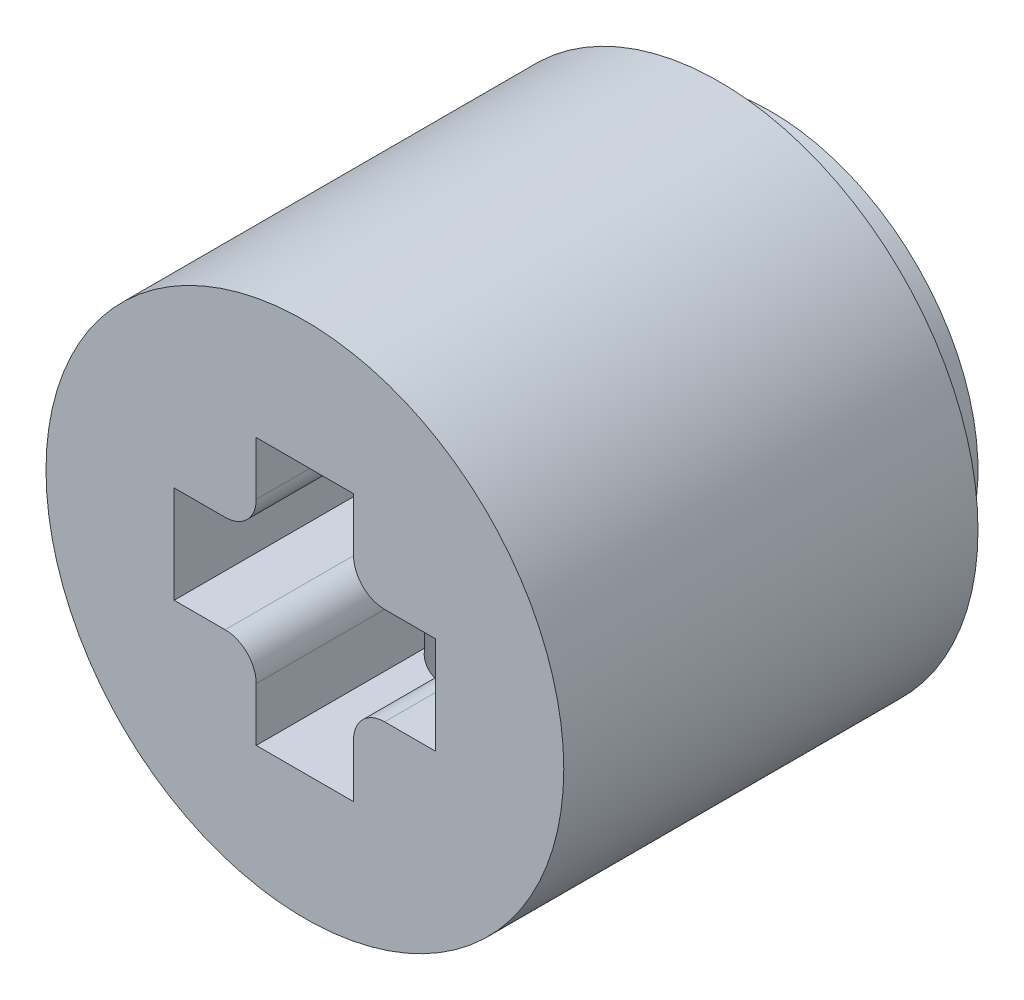
from build123d import *

# Parameters (mm, degrees)
SKETCH_1_R               = 5
EXTRUDE_1_DEPTH          = 8
SKETCH_4_R               = 4
EXTRUDE_2_DEPTH          = 1
SKETCH_2_W               = 5.05
SKETCH_2_H               = 1.88
SKETCH_2_W_2             = 1.88
SKETCH_2_H_2             = 5.15
CUT_EXTRUDE_1_DEPTH      = 12.445523142
FILLET_1_R               = 0.6
CUT_EXTRUDE_2_DEPTH      = 0.5
CUT_EXTRUDE_2_DEPTH_BACK = 13.098786096
SKETCH_3_R               = 1.2


with BuildPart() as part:
    # ｽｹｯﾁ1 → ﾎﾞｽ - 押し出し1 (new body)
    with BuildSketch(Plane.XY):
        Circle(SKETCH_1_R)
    extrude(amount=EXTRUDE_1_DEPTH)

    # ｽｹｯﾁ4 → ﾎﾞｽ - 押し出し2 (add)
    with BuildSketch(Plane(origin=(0, 0, 0), x_dir=(-1, 0, 0), z_dir=(0, 0, -1))):
        Circle(SKETCH_4_R)
    extrude(amount=EXTRUDE_2_DEPTH)

    # ｽｹｯﾁ2 → ｶｯﾄ - 押し出し1 (cut, through all)
    with BuildSketch(Plane.XY.offset(8)):
        Rectangle(SKETCH_2_W, SKETCH_2_H)
        Rectangle(SKETCH_2_W_2, SKETCH_2_H_2)
    extrude(amount=-CUT_EXTRUDE_1_DEPTH, mode=Mode.SUBTRACT)

    # ﾌｨﾚｯﾄ1
    fillet_1_edges = [part.edges().sort_by_distance(p)[0] for p in [
        (-0.94, 0.94, 3.5),
        (0.94, -0.94, 3.5),
        (-0.94, -0.94, 3.5),
        (0.94, 0.94, 3.5),
    ]]
    fillet(fillet_1_edges, radius=FILLET_1_R)

    # ｽｹｯﾁ3 → ｶｯﾄ - 押し出し2 (cut, two sides: drawn at the far end of the back side and taken through both)
    with BuildSketch(Plane(origin=(0, -2.575, 0), x_dir=(1, 0, 0), z_dir=(0, 1, 0)).offset(-CUT_EXTRUDE_2_DEPTH_BACK)):
        with Locations(Location((0, -4, 0), (0, 0, 90))):
            Circle(SKETCH_3_R)
    extrude(amount=CUT_EXTRUDE_2_DEPTH + CUT_EXTRUDE_2_DEPTH_BACK, mode=Mode.SUBTRACT)


solid = part.part
